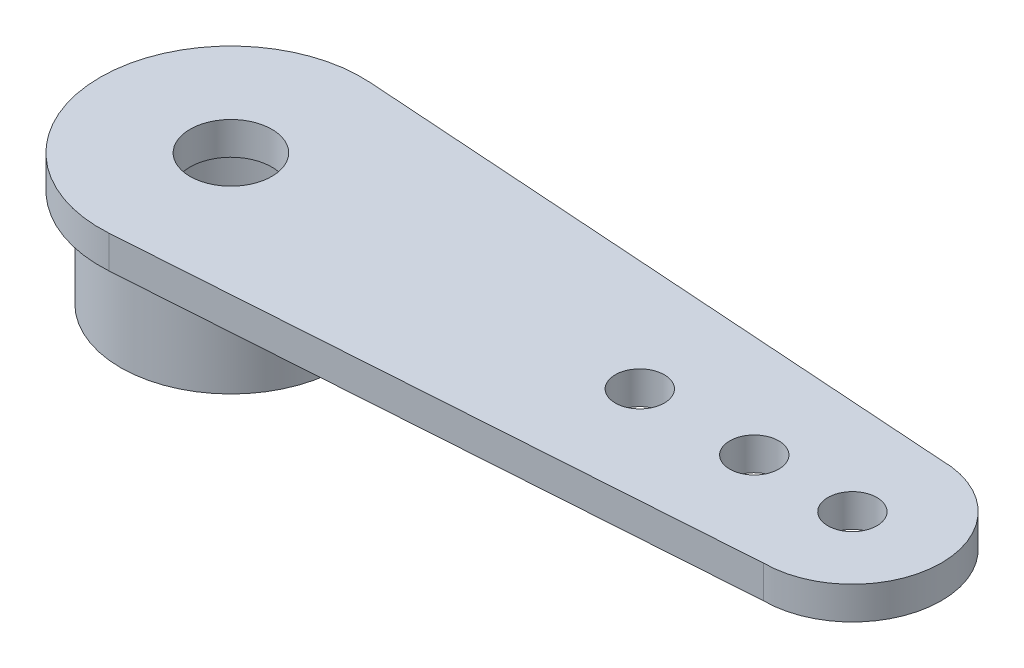
from build123d import *

# Parameters (mm, degrees)
SKETCH5_R           = 3.429
SKETCH5_R_2         = 2.794
BOSS_EXTRUDE3_DEPTH = 3.048
SKETCH6_R           = 0.762
SKETCH6_R_2         = 1.27
BOSS_EXTRUDE4_DEPTH = 1.016


with BuildPart() as part:
    # Sketch5 → Boss-Extrude3 (new body)
    with BuildSketch(Plane(origin=(0, 0, 0), x_dir=(1, 0, 0), z_dir=(0, 1, 0))):
        with Locations(Location((0, 0, 0), (0, 0, 90))):
            Circle(SKETCH5_R)
        with Locations(Location((0, 0, 0), (0, 0, 90))):
            Circle(SKETCH5_R_2, mode=Mode.SUBTRACT)
    extrude(amount=BOSS_EXTRUDE3_DEPTH)

    # Sketch6 → Boss-Extrude4 (add)
    with BuildSketch(Plane(origin=(0, 3.048, 0), x_dir=(1, 0, 0), z_dir=(0, 1, 0))):
        with BuildLine():
            ThreePointArc((0.275010076, 4.054684385), (-4.064, 0), (0.275010076, -4.054684385))
            Line((0.275010076, -4.054684385), (19.304, -2.764037947))
            ThreePointArc((19.304, -2.764037947), (22.068037947, 0), (19.304, 2.764037947))
            Line((19.304, 2.764037947), (0.275010076, 4.054684385))
        make_face()
        with Locations(Location((16.256, 0, 0), (0, 0, 270))):
            Circle(SKETCH6_R, mode=Mode.SUBTRACT)
        with Locations(Location((12.7, 0, 0), (0, 0, 270))):
            Circle(SKETCH6_R, mode=Mode.SUBTRACT)
        with Locations(Location((0, 0, 0), (0, 0, 270))):
            Circle(SKETCH6_R_2, mode=Mode.SUBTRACT)
        with Locations(Location((19.304, 0, 0), (0, 0, 270))):
            Circle(SKETCH6_R, mode=Mode.SUBTRACT)
    extrude(amount=BOSS_EXTRUDE4_DEPTH)


solid = part.part
